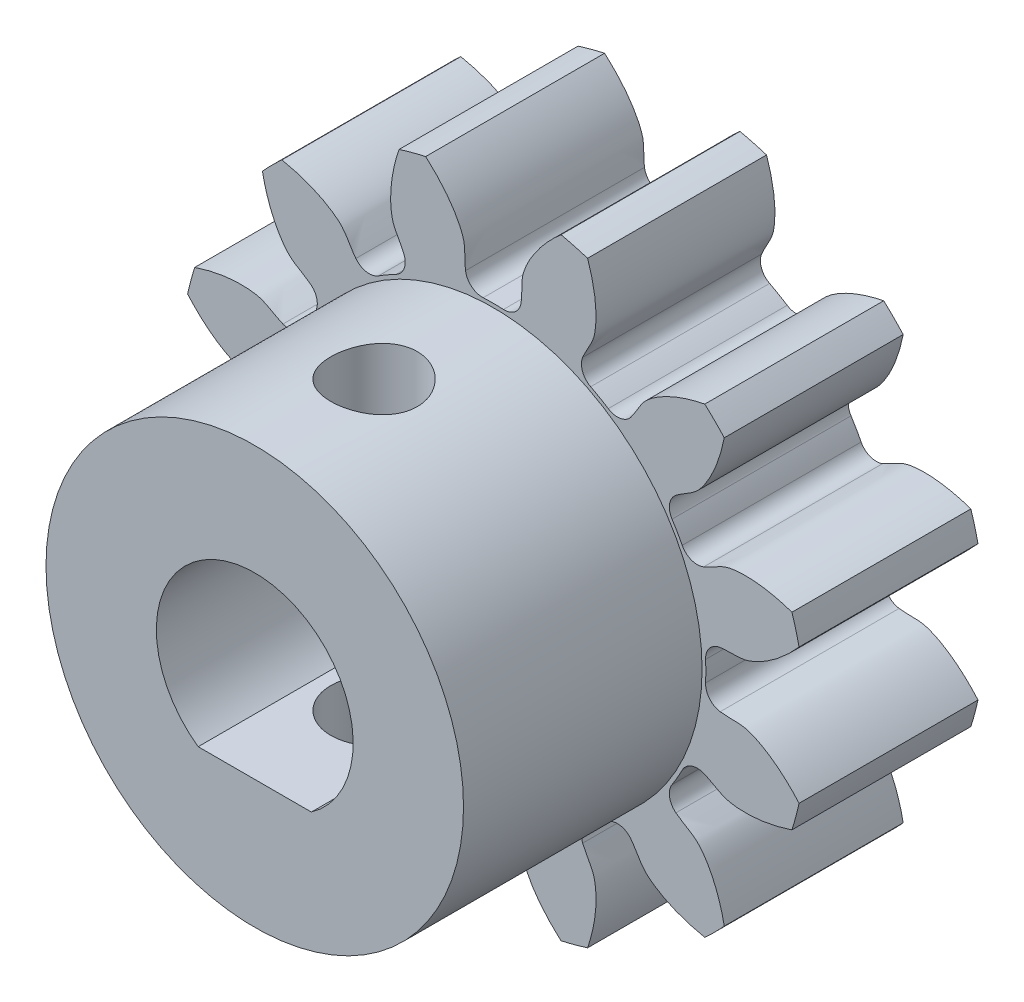
from build123d import *

# Parameters (mm, degrees)
SKETCH_1_R               = 10.5
LASHENA_DEPTH            = 6
CUT_EXTRUDEA_DEPTH       = 6
WWW_KYTOOL_CN_COUNT      = 12
SKETCH_3_R               = 7
EXTRUDE_2_DEPTH          = 8
CUT_EXTRUDE_2_DEPTH      = 17.559057685
CUT_EXTRUDE_3_DEPTH      = 22.653004029
CUT_EXTRUDE_3_DEPTH_BACK = 22.653004029
SKETCH_5_R               = 1.45


with BuildPart() as part:
    # 草图1 → LaShenA (new body)
    with BuildSketch(Plane.XY):
        Circle(SKETCH_1_R)
    extrude(amount=LASHENA_DEPTH)

    # SketchA → Cut-ExtrudeA (cut)
    with BuildSketch(Plane.XY.offset(6)):
        with BuildLine():
            ThreePointArc((0.340361482, 7.116865817), (0, 7.125), (-0.340361482, 7.116865817))
            ThreePointArc((-0.340361482, 7.116865817), (-0.731187841, 7.247242531), (-0.932053472, 7.606959544))
            add(Edge.make_bspline(
                [(-0.932053472, 7.606959544), (-0.968971266, 7.869890457), (-0.930792682, 8.175512036), (-0.99921024, 8.484739766), (-1.019367589, 8.551131212), (-1.036896876, 8.603524535), (-1.059078238, 8.663288747), (-1.086323911, 8.730201148), (-1.119128878, 8.803983826), (-1.157945239, 8.884346708), (-1.203221646, 8.970974273), (-1.255389548, 9.063530485), (-1.314866275, 9.161658014), (-1.382052917, 9.26497928), (-1.457333829, 9.373096988), (-1.541075679, 9.485594855), (-1.63362667, 9.602038333), (-1.735315742, 9.721975367), (-1.846451826, 9.844937187), (-1.967323111, 9.970439127), (-2.098196365, 10.09798148), (-2.239316258, 10.227050368), (-2.390904787, 10.357118651), (-2.553160504, 10.487646869), (-2.788483535, 10.664973315), (-2.974795492, 10.791708594), (-3.103842082, 10.873850116)],
                knots=[0.119741213, 0.119741213, 0.119741213, 0.119741213, 0.289278755, 0.31192767, 0.321899734, 0.3336849, 0.347283168, 0.362694538, 0.379919011, 0.398956585, 0.419807262, 0.442471041, 0.466947923, 0.493237906, 0.521340992, 0.55125718, 0.582986471, 0.616528863, 0.651884358, 0.689052956, 0.728034655, 0.768829457, 0.811437361, 0.855858367, 0.902092476, 1, 1, 1, 1], degree=3))
            ThreePointArc((-3.103842082, 10.873850116), (0, 11.308158649), (3.103842082, 10.873850116))
            add(Edge.make_bspline(
                [(0.932053472, 7.606959544), (0.968971266, 7.869890457), (0.930792682, 8.175512036), (0.99921024, 8.484739766), (1.019367589, 8.551131212), (1.036896876, 8.603524535), (1.059078238, 8.663288747), (1.086323911, 8.730201148), (1.119128878, 8.803983826), (1.157945239, 8.884346708), (1.203221646, 8.970974273), (1.255389548, 9.063530485), (1.314866275, 9.161658014), (1.382052917, 9.26497928), (1.457333829, 9.373096988), (1.541075679, 9.485594855), (1.63362667, 9.602038333), (1.735315742, 9.721975367), (1.846451826, 9.844937187), (1.967323111, 9.970439127), (2.098196365, 10.09798148), (2.239316258, 10.227050368), (2.390904787, 10.357118651), (2.553160504, 10.487646869), (2.788483535, 10.664973315), (2.974795492, 10.791708594), (3.103842082, 10.873850116)],
                knots=[0.119741213, 0.119741213, 0.119741213, 0.119741213, 0.289278755, 0.31192767, 0.321899734, 0.3336849, 0.347283168, 0.362694538, 0.379919011, 0.398956585, 0.419807262, 0.442471041, 0.466947923, 0.493237906, 0.521340992, 0.55125718, 0.582986471, 0.616528863, 0.651884358, 0.689052956, 0.728034655, 0.768829457, 0.811437361, 0.855858367, 0.902092476, 1, 1, 1, 1], degree=3))
            ThreePointArc((0.932053472, 7.606959544), (0.731187841, 7.247242531), (0.340361482, 7.116865817))
        make_face()
    cut_extrudea = extrude(amount=-CUT_EXTRUDEA_DEPTH, mode=Mode.SUBTRACT)

    # www.KYTool.cn: Cut-ExtrudeA ×12 about axis
    www_kytool_cn_axis = Axis((0, 0, -88.99), (0, 0, 1))
    for i in range(1, WWW_KYTOOL_CN_COUNT):
        add(cut_extrudea.rotate(www_kytool_cn_axis, i * 360 / WWW_KYTOOL_CN_COUNT), mode=Mode.SUBTRACT)

    # 草图3 → 凸台-拉伸2 (add)
    with BuildSketch(Plane.XY.offset(6)):
        Circle(SKETCH_3_R)
        with BuildLine():
            Line((1.897366596, -2.7), (-1.897366596, -2.7))
            ThreePointArc((-1.897366596, -2.7), (0, 3.3), (1.897366596, -2.7))
        make_face(mode=Mode.SUBTRACT)
    extrude(amount=EXTRUDE_2_DEPTH)

    # 草图4 → 切除-拉伸2 (cut, through all)
    with BuildSketch(Plane.XY.offset(6)):
        with BuildLine():
            Line((1.897366596, -2.7), (-1.897366596, -2.7))
            ThreePointArc((-1.897366596, -2.7), (0, 3.3), (1.897366596, -2.7))
        make_face()
    extrude(amount=-CUT_EXTRUDE_2_DEPTH, mode=Mode.SUBTRACT)

    # 草图5 → 切除-拉伸3 (cut, two sides: drawn at the far end of the back side and taken through both)
    with BuildSketch(Plane(origin=(0, -2.7, 0), x_dir=(1, 0, 0), z_dir=(0, 1, 0)).offset(-CUT_EXTRUDE_3_DEPTH_BACK)):
        with Locations(Location((0, -10, 0), (0, 0, 270))):
            Circle(SKETCH_5_R)
    extrude(amount=CUT_EXTRUDE_3_DEPTH + CUT_EXTRUDE_3_DEPTH_BACK, mode=Mode.SUBTRACT)


solid = part.part
